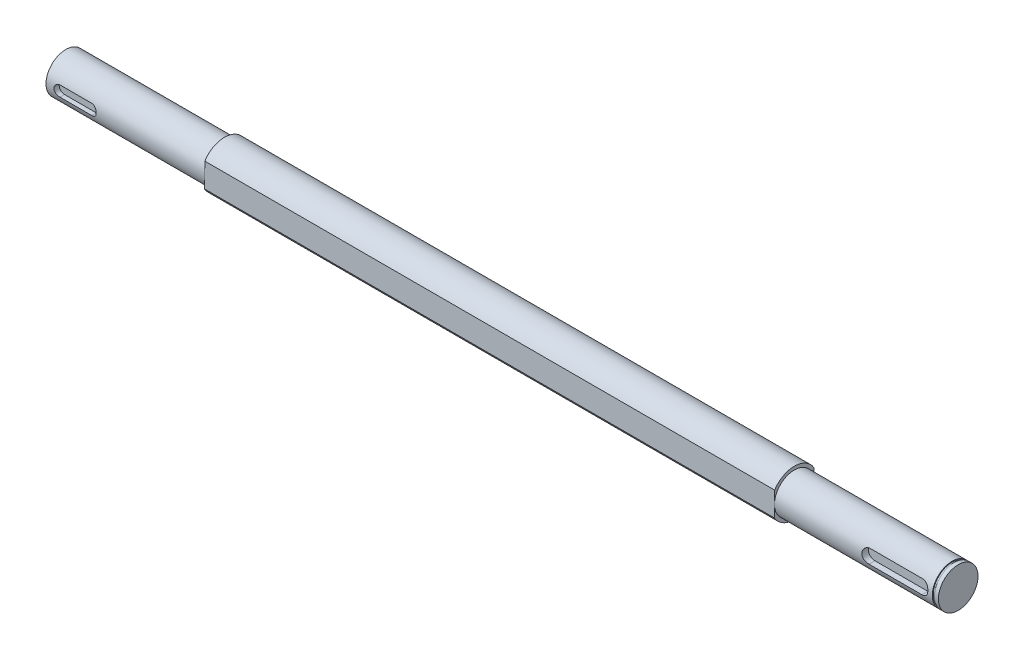
from build123d import *

# Parameters (mm, degrees)
KES_EKSTR_ZYON1_DEPTH = 431
KES_EKSTR_ZYON2_DEPTH = 4
IZIM4_W               = 1.6
IZIM4_H               = 0.7
KES_EKSTR_ZYON3_DEPTH = 5


with BuildPart() as part:
    # Çizim1 → Döndür1 (revolve)
    with BuildSketch(Plane.XY, mode=Mode.PRIVATE) as d_nd_r1_sk:
        Polygon((-337.5, 0), (337.5, 0), (337.5, 15), (213.5, 15), (213.5, 17.5), (-217.5, 17.5), (-217.5, 15), (-337.5, 15), align=None)
    revolve(d_nd_r1_sk.sketch.rotate(Axis((-337.5, 0, 0), (1, 0, 0)), 90), axis=Axis((-337.5, 0, 0), (1, 0, 0)))

    # Çizim2 → Kes-Ekstrüzyon1 (cut)
    with BuildSketch(Plane.ZY.offset(217.5)):
        with BuildLine():
            Line((-14.843898339, 9.268693657), (-15.15172785, -8.756434386))
            ThreePointArc((-15.15172785, -8.756434386), (-17.49744861, 0.298817908), (-14.843898339, 9.268693657))
        make_face()
        with BuildLine():
            Line((14.843898339, 9.268693657), (15.15172785, -8.756434386))
            ThreePointArc((15.15172785, -8.756434386), (17.49744861, 0.298817908), (14.843898339, 9.268693657))
        make_face()
    extrude(amount=-KES_EKSTR_ZYON1_DEPTH, mode=Mode.SUBTRACT)

    # Çizim3 → Kes-Ekstrüzyon2 (cut)
    with BuildSketch(Plane.XY.offset(15)):
        with BuildLine():
            Line((-327.5, 4), (-303.5, 4))
            ThreePointArc((-303.5, 4), (-299.5, 0), (-303.5, -4))
            Line((-303.5, -4), (-327.5, -4))
            ThreePointArc((-327.5, -4), (-331.5, 0), (-327.5, 4))
        make_face()
    extrude(amount=-KES_EKSTR_ZYON2_DEPTH, mode=Mode.SUBTRACT)

    # Çizim4 → Kes-Döndür1 (revolve, cut)
    with BuildSketch(Plane.XY, mode=Mode.PRIVATE) as kes_d_nd_r1_sk:
        with Locations((333.7, 14.65)):
            Rectangle(IZIM4_W, IZIM4_H)
    revolve(kes_d_nd_r1_sk.sketch.rotate(Axis((337.5, 0, 0), (-1, 0, 0)), 270), axis=Axis((337.5, 0, 0), (-1, 0, 0)), mode=Mode.SUBTRACT)

    # Çizim5 → Kes-Ekstrüzyon3 (cut)
    with BuildSketch(Plane.XY.offset(15)):
        with BuildLine():
            Line((284.5, 6.07346209), (324.5, 6.07346209))
            ThreePointArc((324.5, 6.07346209), (329.5, 1.07346209), (324.5, -3.92653791))
            Line((324.5, -3.92653791), (284.5, -3.92653791))
            ThreePointArc((284.5, -3.92653791), (279.5, 1.07346209), (284.5, 6.07346209))
        make_face()
    extrude(amount=-KES_EKSTR_ZYON3_DEPTH, mode=Mode.SUBTRACT)


solid = part.part
